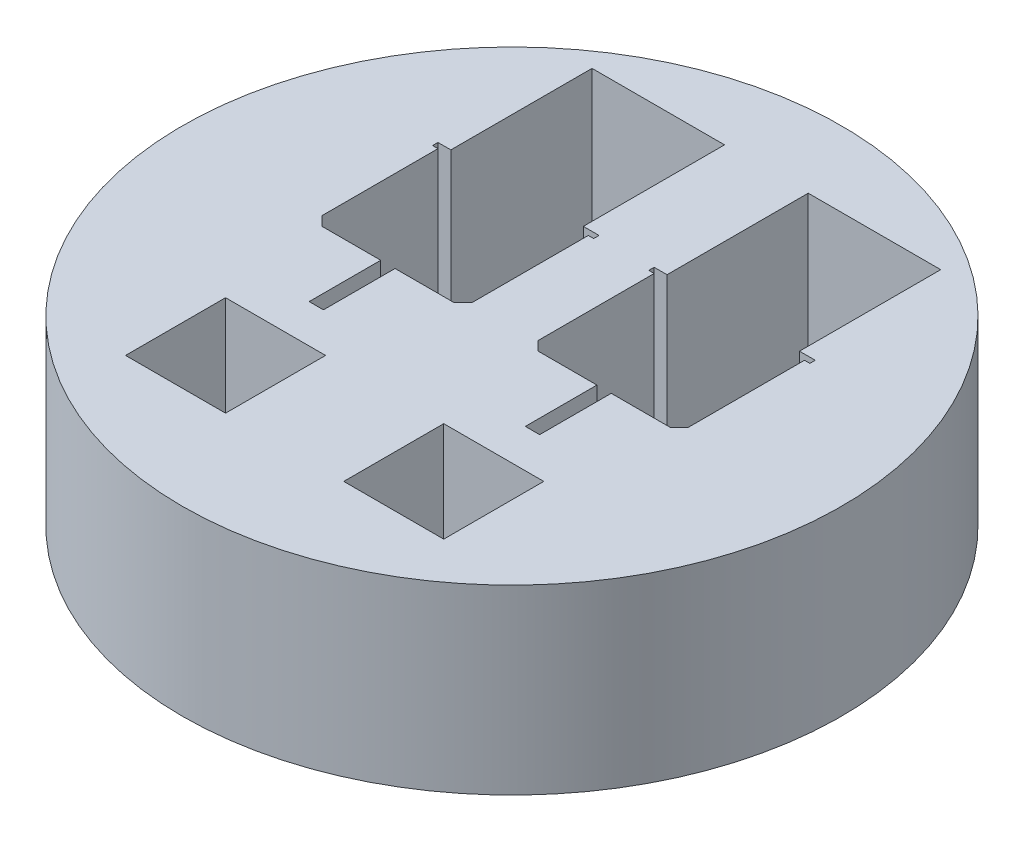
from build123d import *

# Parameters (mm, degrees)
SKETCH1_R           = 92.075
BOSS_EXTRUDE1_DEPTH = 50.8
SKETCH6_W           = 27.94
SKETCH6_H           = 27.94
CUT_EXTRUDE4_DEPTH  = 50.8
CUT_EXTRUDE5_DEPTH  = 50.8


with BuildPart() as part:
    # Sketch1 → Boss-Extrude1 (new body)
    with BuildSketch(Plane(origin=(0, 0, 0), x_dir=(1, 0, 0), z_dir=(0, 1, 0))):
        with Locations(Location((0, 0, 0), (0, 0, 270))):
            Circle(SKETCH1_R)
    extrude(amount=BOSS_EXTRUDE1_DEPTH)

    # Sketch6 → Cut-Extrude4 (cut)
    with BuildSketch(Plane.XZ):
        with Locations((30.48, 49.53)):
            Rectangle(SKETCH6_W, SKETCH6_H)
        with Locations((-30.48, 49.53)):
            Rectangle(SKETCH6_W, SKETCH6_H)
    extrude(amount=-CUT_EXTRUDE4_DEPTH, mode=Mode.SUBTRACT)

    # Sketch8 → Cut-Extrude5 (cut)
    with BuildSketch(Plane(origin=(0, 50.8, 0), x_dir=(1, 0, 0), z_dir=(0, 1, 0))):
        Polygon((48.673227998, 66.920620093), (48.673227998, 31.675), (53.066023648, 31.675), (53.066023648, 30.175), (51.568299971, 30.175), (51.568299971, -2.285), (49.028299971, -4.825), (32.568299971, -4.825), (32.568299971, -24.825), (28.568299971, -24.825), (28.568299971, -4.825), (12.108299971, -4.825), (9.568299971, -2.285), (9.568299971, 30.175), (8.06602381, 30.175), (8.06602381, 31.675), (10.838299971, 31.675), (11.658892904, 31.675), (11.658892904, 66.920620093), (11.658892904, 71.12), (48.673227998, 71.12), align=None)
        Polygon((-8.831700029, -2.285), (-11.371700029, -4.825), (-27.831700029, -4.825), (-27.831700029, -24.825), (-31.831700029, -24.825), (-31.831700029, -4.825), (-48.291700029, -4.825), (-50.831700029, -2.285), (-50.831700029, 30.175), (-52.33397619, 30.175), (-52.33397619, 31.675), (-48.741107096, 31.675), (-48.741107096, 66.920620093), (-48.741107096, 71.12), (-11.726772002, 71.12), (-11.726772002, 66.920620093), (-11.726772002, 31.675), (-7.333976352, 31.675), (-7.333976352, 30.175), (-8.831700029, 30.175), align=None)
    extrude(amount=-CUT_EXTRUDE5_DEPTH, mode=Mode.SUBTRACT)


solid = part.part
